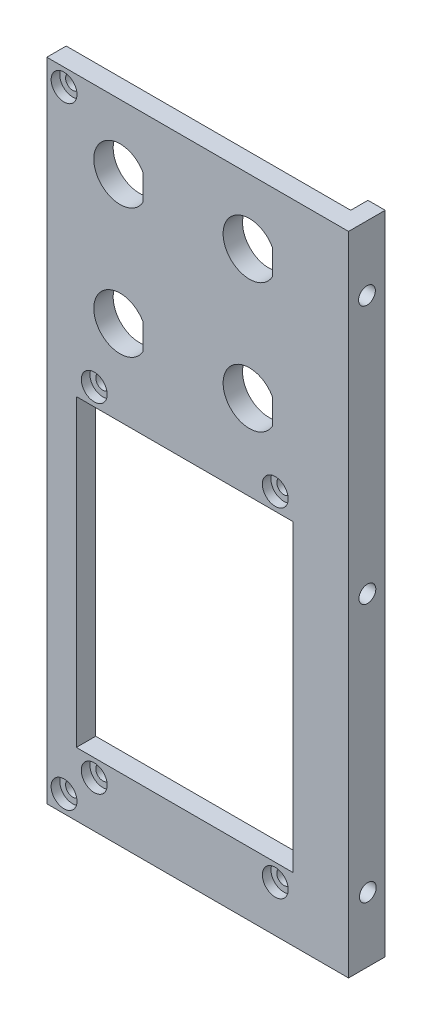
from build123d import *

# Parameters (mm, degrees)
SKETCH1_W           = 150
SKETCH1_H           = 70
BOSS_EXTRUDE1_DEPTH = 4.5
SKETCH2_W           = 50.3
SKETCH2_H           = 70.5
CUT_EXTRUDE1_DEPTH  = 166.590609637
CUT_EXTRUDE2_DEPTH  = 166.590609637
SKETCH4_R           = 1.65
CUT_EXTRUDE3_DEPTH  = 166.590609637
SKETCH5_R           = 3
CUT_EXTRUDE4_DEPTH  = 2
SKETCH7_W           = 4
SKETCH7_H           = 150
BOSS_EXTRUDE2_DEPTH = 4
SKETCH8_R           = 1.95
CUT_EXTRUDE5_DEPTH  = 10
SKETCH10_W          = 13
SKETCH10_H          = 45
CUT_EXTRUDE6_DEPTH  = 1


with BuildPart() as part:
    # Sketch1 → Boss-Extrude1 (new body)
    with BuildSketch(Plane(origin=(0, 0, 0), x_dir=(0, 1, 0), z_dir=(0, 0, 1))):
        with Locations((75, 35)):
            Rectangle(SKETCH1_W, SKETCH1_H)
    extrude(amount=BOSS_EXTRUDE1_DEPTH)

    # Sketch2 → Cut-Extrude1 (cut, through all)
    with BuildSketch(Plane(origin=(0, 0, 0), x_dir=(1, 0, 0), z_dir=(0, 0, -1))):
        with Locations((-38, -50)):
            Rectangle(SKETCH2_W, SKETCH2_H)
    extrude(amount=-CUT_EXTRUDE1_DEPTH, mode=Mode.SUBTRACT)

    # Sketch3 → Cut-Extrude2 (cut, through all)
    with BuildSketch(Plane.XY.offset(4.5)):
        with BuildLine():
            Line((-47.68869131, 108), (-47.68869131, 102))
            ThreePointArc((-47.68869131, 102), (-59.1, 105), (-47.68869131, 108))
        make_face()
        with BuildLine():
            Line((-47.68869131, 138), (-47.68869131, 132))
            ThreePointArc((-47.68869131, 132), (-59.1, 135), (-47.68869131, 138))
        make_face()
        with BuildLine():
            Line((-17.68869131, 138), (-17.68869131, 132))
            ThreePointArc((-17.68869131, 132), (-29.1, 135), (-17.68869131, 138))
        make_face()
        with BuildLine():
            Line((-17.68869131, 108), (-17.68869131, 102))
            ThreePointArc((-17.68869131, 102), (-29.1, 105), (-17.68869131, 108))
        make_face()
    extrude(amount=-CUT_EXTRUDE2_DEPTH, mode=Mode.SUBTRACT)

    # Sketch4 → Cut-Extrude3 (cut, through all)
    with BuildSketch(Plane.XY.offset(4.5)):
        with Locations((-59, 89.25)):
            Circle(SKETCH4_R)
        with Locations((-17, 89.25)):
            Circle(SKETCH4_R)
        with Locations((-17, 10.75)):
            Circle(SKETCH4_R)
        with Locations((-59, 10.75)):
            Circle(SKETCH4_R)
        with Locations((-66, 146)):
            Circle(SKETCH4_R)
        with Locations((-66, 4)):
            Circle(SKETCH4_R)
    extrude(amount=-CUT_EXTRUDE3_DEPTH, mode=Mode.SUBTRACT)

    # Sketch5 → Cut-Extrude4 (cut)
    with BuildSketch(Plane.XY.offset(4.5)):
        with Locations((-59, 89.25)):
            Circle(SKETCH5_R)
        with Locations((-17, 89.25)):
            Circle(SKETCH5_R)
        with Locations((-17, 10.75)):
            Circle(SKETCH5_R)
        with Locations((-59, 10.75)):
            Circle(SKETCH5_R)
        with Locations((-66, 146)):
            Circle(SKETCH5_R)
        with Locations((-66, 4)):
            Circle(SKETCH5_R)
    extrude(amount=-CUT_EXTRUDE4_DEPTH, mode=Mode.SUBTRACT)

    # Sketch7 → Boss-Extrude2 (add)
    with BuildSketch(Plane(origin=(0, 0, 0), x_dir=(1, 0, 0), z_dir=(0, 0, -1))):
        with Locations((-2, -75)):
            Rectangle(SKETCH7_W, SKETCH7_H)
    extrude(amount=BOSS_EXTRUDE2_DEPTH)

    # Sketch8 → Cut-Extrude5 (cut)
    with BuildSketch(Plane.YZ):
        with Locations(Location((15, 0.025, 0), (0, 0, 270))):
            Circle(SKETCH8_R)
        with Locations(Location((75, 0.125, 0), (0, 0, 270))):
            Circle(SKETCH8_R)
        with Locations(Location((135, 0.225, 0), (0, 0, 270))):
            Circle(SKETCH8_R)
    extrude(amount=-CUT_EXTRUDE5_DEPTH, mode=Mode.SUBTRACT)

    # Sketch10 → Cut-Extrude6 (cut)
    with BuildSketch(Plane(origin=(0, 0, 0), x_dir=(1, 0, 0), z_dir=(0, 0, -1))):
        with Locations((-38, -107.75)):
            Rectangle(SKETCH10_W, SKETCH10_H)
    extrude(amount=-CUT_EXTRUDE6_DEPTH, mode=Mode.SUBTRACT)


solid = part.part
